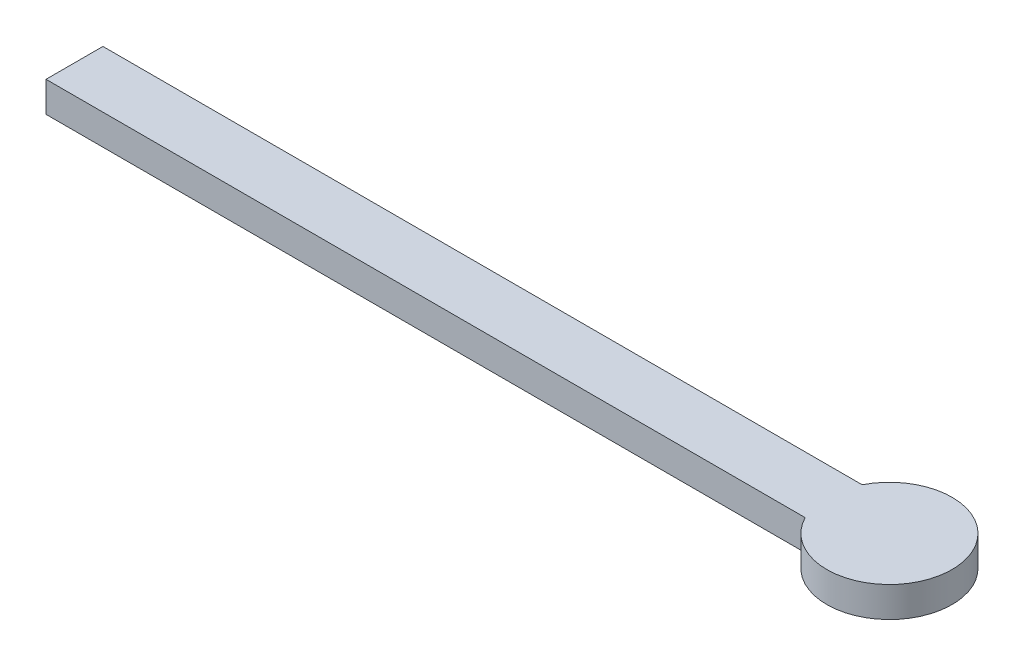
from build123d import *

# Parameters (mm, degrees)
BOSS_EXTRUDE1_DEPTH = 8


with BuildPart() as part:
    # Sketch1 → Boss-Extrude1 (new body)
    with BuildSketch(Plane(origin=(0, 0, 0), x_dir=(1, 0, 0), z_dir=(0, 1, 0))):
        with BuildLine():
            Line((-14.696938457, 7.5), (-214.696938457, 7.5))
            Line((-214.696938457, 7.5), (-214.696938457, -7.5))
            Line((-214.696938457, -7.5), (-14.696938457, -7.5))
            ThreePointArc((-14.696938457, -7.5), (16.5, 0), (-14.696938457, 7.5))
        make_face()
    extrude(amount=BOSS_EXTRUDE1_DEPTH)


solid = part.part
